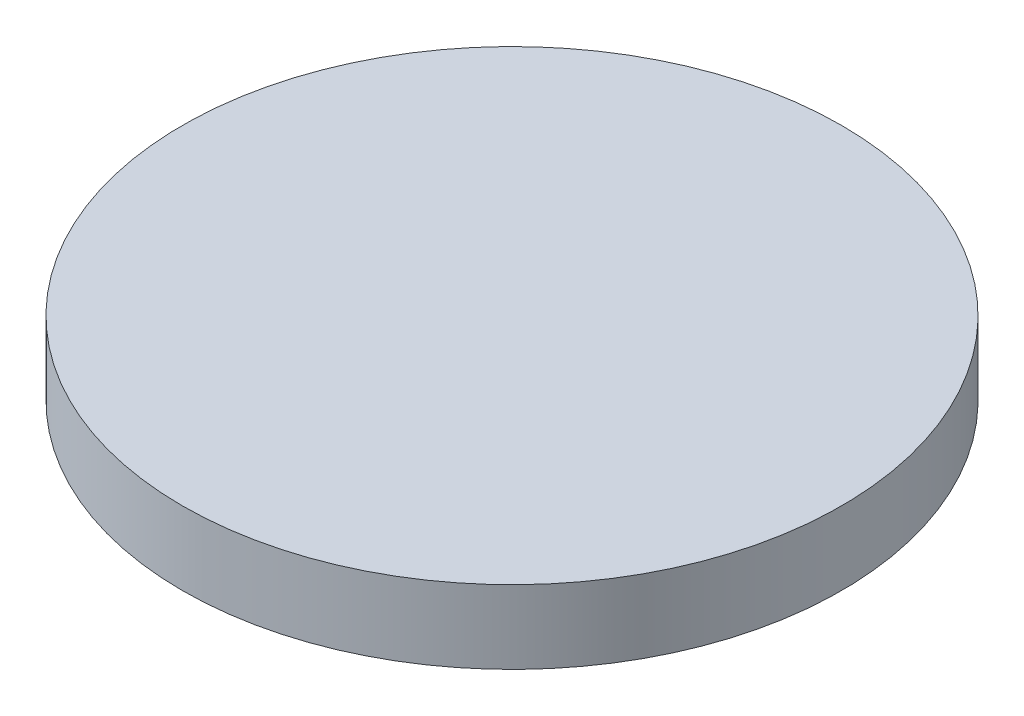
from build123d import *

# Parameters (mm, degrees)
CROQUIS1_R              = 44.9
SALIENTE_EXTRUIR1_DEPTH = 10


with BuildPart() as part:
    # Croquis1 → Saliente-Extruir1 (new body)
    with BuildSketch(Plane(origin=(0, 0, 0), x_dir=(1, 0, 0), z_dir=(0, 1, 0))):
        with Locations(Location((0, 0, 0), (0, 0, 270))):
            Circle(CROQUIS1_R)
    extrude(amount=SALIENTE_EXTRUIR1_DEPTH)


solid = part.part
